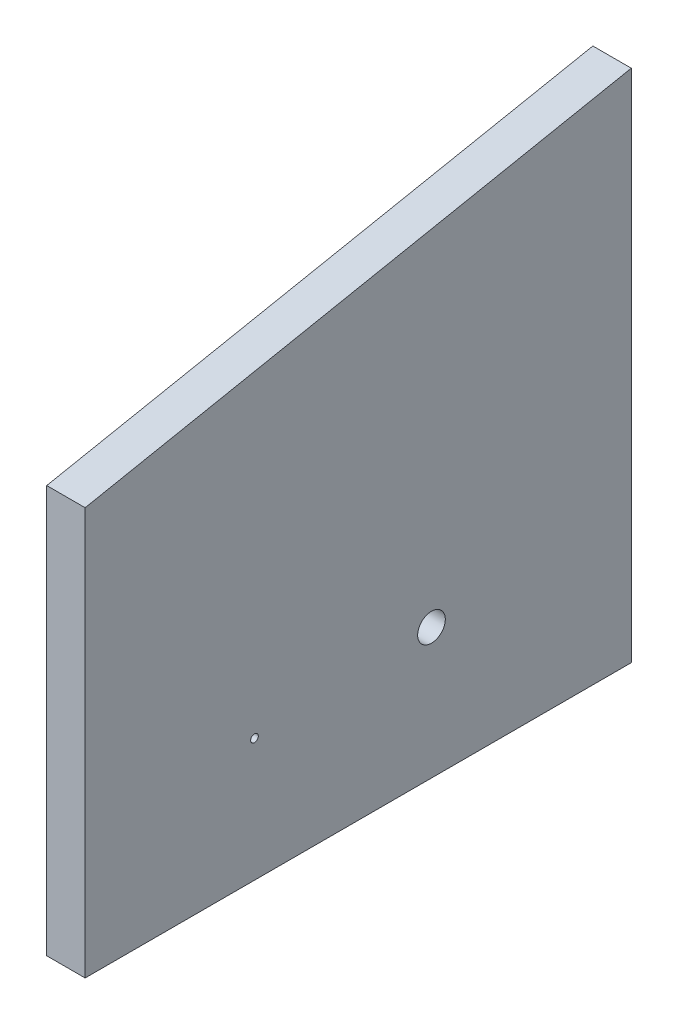
from build123d import *

# Parameters (mm, degrees)
SKETCH1_W                = 50
SKETCH1_H                = 9.1
BOSS_EXTRUDE1_DEPTH      = 2
SKETCH2_W                = 25
SKETCH2_H                = 6.6
CUT_EXTRUDE1_DEPTH       = 2
SKETCH3_R                = 1.8
CUT_EXTRUDE2_DEPTH       = 2
SKETCH4_W                = 66.4
SKETCH4_H                = 130
BOSS_EXTRUDE2_DEPTH      = 2
SKETCH5_W                = 66.4
SKETCH5_H                = 2
BOSS_EXTRUDE3_DEPTH      = 2.5
SKETCH6_W                = 8.6
SKETCH6_H                = 62.5
BOSS_EXTRUDE4_DEPTH      = 2
SKETCH7_R                = 1.8
SKETCH7_W                = 3
SKETCH7_H                = 5
CUT_EXTRUDE3_DEPTH       = 2
SKETCH8_W                = 25
SKETCH8_H                = 45
CUT_EXTRUDE4_DEPTH       = 20
SKETCH9_W                = 25
SKETCH9_H                = 10
BOSS_EXTRUDE5_DEPTH      = 2
SKETCH10_W               = 34.7
SKETCH10_H               = 27.07
BOSS_EXTRUDE6_DEPTH      = 2
SKETCH11_R               = 1.8
CUT_EXTRUDE5_DEPTH       = 2
SKETCH12_R               = 1.8
CUT_EXTRUDE6_DEPTH       = 2
SKETCH13_W               = 2
SKETCH13_H               = 2
BOSS_EXTRUDE7_DEPTH      = 44
SKETCH14_W               = 2
SKETCH14_H               = 2
BOSS_EXTRUDE8_DEPTH      = 46
SKETCH16_W               = 42
SKETCH16_H               = 43
BOSS_EXTRUDE10_DEPTH     = 2
SKETCH18_R               = 1.8
CUT_EXTRUDE7_DEPTH       = 2
BOSS_EXTRUDE12_DEPTH     = 2
SKETCH21_W               = 2
SKETCH21_H               = 2
BOSS_EXTRUDE13_DEPTH     = 10
SKETCH25_W               = 3
SKETCH25_H               = 5
CUT_EXTRUDE8_DEPTH       = 10
SKETCH26_W               = 6.2
SKETCH26_H               = 13
SKETCH26_W_2             = 21
SKETCH26_H_2             = 6.6
BOSS_EXTRUDE14_DEPTH     = 2
SKETCH27_W               = 2
SKETCH27_H               = 27
SKETCH27_H_2             = 24.93
BOSS_EXTRUDE15_DEPTH     = 2
SKETCH29_W               = 10
SKETCH29_H               = 10
BOSS_EXTRUDE19_DEPTH     = 2
SKETCH41_R               = 1.8
CUT_EXTRUDE15_DEPTH      = 2
BOSS_EXTRUDE26_DEPTH     = 2
SKETCH43_W               = 70.4
SKETCH43_H               = 2
BOSS_EXTRUDE27_DEPTH     = 11
SKETCH44_W               = 10
SKETCH44_H               = 5
BOSS_EXTRUDE28_DEPTH     = 2
SKETCH45_R               = 1.8
BOSS_EXTRUDE29_DEPTH     = 2
SKETCH46_R               = 1.8
CUT_EXTRUDE16_DEPTH      = 2
SKETCH47_W               = 10
SKETCH47_H               = 1
BOSS_EXTRUDE30_DEPTH     = 2
SKETCH48_W               = 32.7
SKETCH48_H               = 31.07
SKETCH48_W_2             = 101.75
SKETCH48_H_2             = 120.487369876
CUT_EXTRUDE17_DEPTH      = 20
SKETCH50_W               = 66.4
SKETCH50_H               = 81.07
CUT_EXTRUDE19_DEPTH      = 20
SKETCH51_W               = 70.4
SKETCH51_H               = 85.07
SKETCH51_W_2             = 66.4
SKETCH51_H_2             = 81.07
BOSS_EXTRUDE31_DEPTH     = 20
SKETCH52_W               = 10
SKETCH52_H               = 1
BOSS_EXTRUDE32_DEPTH     = 2
SKETCH53_W               = 10
SKETCH53_H               = 4
CUT_EXTRUDE20_DEPTH      = 2
BOSS_EXTRUDE33_START     = 1
SKETCH54_W               = 10
SKETCH54_H               = 12
SKETCH54_R               = 1.8
BOSS_EXTRUDE33_DEPTH     = 1
CUT_EXTRUDE23_DEPTH      = 96
CUT_EXTRUDE23_DEPTH_BACK = 16
SKETCH59_R               = 1.8
SKETCH62_W               = 66.985033768
SKETCH62_H               = 11.249394984
BOSS_EXTRUDE38_DEPTH     = 1
SKETCH65_R               = 1.8
CUT_EXTRUDE27_DEPTH      = 3
SKETCH66_R               = 1
CUT_EXTRUDE28_DEPTH      = 87
BOSS_EXTRUDE41_DEPTH     = 2
BOSS_EXTRUDE42_DEPTH     = 2
BOSS_EXTRUDE43_DEPTH     = 2
SKETCH68_W               = 6.791832398
SKETCH68_H               = 8.144168394
SKETCH68_W_2             = 5.485710784
SKETCH68_W_3             = 7.764004839
SKETCH68_H_2             = 11.628907231
BOSS_EXTRUDE44_DEPTH     = 2
BOSS_EXTRUDE45_DEPTH     = 2
SKETCH70_R               = 1.8
CUT_EXTRUDE29_DEPTH      = 83
CUT_EXTRUDE30_DEPTH      = 75
CUT_EXTRUDE30_DEPTH_BACK = 16
SKETCH71_W               = 5.876146553
SKETCH71_H               = 39.481516924
SKETCH72_W               = 79.610987064
SKETCH72_H               = 92.479142301
CUT_EXTRUDE31_DEPTH      = 40
CUT_EXTRUDE32_DEPTH      = 43
CUT_EXTRUDE32_DEPTH_BACK = 22
SKETCH73_W               = 7.125351406
SKETCH73_H               = 50.874914307
SKETCH74_W               = 52.254946006
SKETCH74_H               = 40.33481622
CUT_EXTRUDE33_DEPTH      = 68
BOSS_EXTRUDE46_START     = 3
SKETCH75_W               = 81.07
SKETCH75_H               = 22
SKETCH75_R               = 1.8
SKETCH75_R_2             = 1
BOSS_EXTRUDE46_DEPTH     = 3
SKETCH76_R               = 1.8
SKETCH76_R_2             = 1
SKETCH76_R_3             = 0.5
BOSS_EXTRUDE47_DEPTH     = 5
SKETCH77_W               = 5
SKETCH77_H               = 22
CUT_EXTRUDE34_DEPTH      = 5
SKETCH78_W               = 5
SKETCH78_H               = 22
CUT_EXTRUDE35_DEPTH      = 5
BOSS_EXTRUDE49_DEPTH     = 5


with BuildPart() as part:
    # Sketch1 → Boss-Extrude1 (new body)
    with BuildSketch(Plane(origin=(0, 0, 0), x_dir=(1, 0, 0), z_dir=(0, 1, 0))):
        with Locations((25, 4.55)):
            Rectangle(SKETCH1_W, SKETCH1_H)
    extrude(amount=BOSS_EXTRUDE1_DEPTH)

    # Sketch2 → Cut-Extrude1 (cut)
    with BuildSketch(Plane(origin=(0, 2, 0), x_dir=(1, 0, 0), z_dir=(0, 1, 0))):
        with Locations((25, 5.8)):
            Rectangle(SKETCH2_W, SKETCH2_H)
    extrude(amount=-CUT_EXTRUDE1_DEPTH, mode=Mode.SUBTRACT)

    # Sketch3 → Cut-Extrude2 (cut)
    with BuildSketch(Plane(origin=(0, 2, 0), x_dir=(1, 0, 0), z_dir=(0, 1, 0))):
        with Locations(Location((6.25, 5.8, 0), (0, 0, 270))):
            Circle(SKETCH3_R)
        with Locations(Location((43.75, 5.8, 0), (0, 0, 270))):
            Circle(SKETCH3_R)
    extrude(amount=-CUT_EXTRUDE2_DEPTH, mode=Mode.SUBTRACT)

    # Sketch4 → Boss-Extrude2 (add)
    with BuildSketch(Plane(origin=(0, 2, 0), x_dir=(1, 0, 0), z_dir=(0, 1, 0))):
        with Locations((25, -65)):
            Rectangle(SKETCH4_W, SKETCH4_H)
    extrude(amount=-BOSS_EXTRUDE2_DEPTH)

    # Sketch5 → Boss-Extrude3 (add)
    with BuildSketch(Plane.XY.offset(130)):
        with Locations((25, 1)):
            Rectangle(SKETCH5_W, SKETCH5_H)
    extrude(amount=BOSS_EXTRUDE3_DEPTH)

    # Sketch6 → Boss-Extrude4 (add)
    with BuildSketch(Plane(origin=(0, 2, 0), x_dir=(1, 0, 0), z_dir=(0, 1, 0))):
        with Locations((-12.5, -101.25)):
            Rectangle(SKETCH6_W, SKETCH6_H)
        with Locations((62.5, -101.25)):
            Rectangle(SKETCH6_W, SKETCH6_H)
    extrude(amount=-BOSS_EXTRUDE4_DEPTH)

    # Sketch7 → Cut-Extrude3 (cut)
    with BuildSketch(Plane(origin=(0, 2, 0), x_dir=(1, 0, 0), z_dir=(0, 1, 0))):
        with Locations(Location((-13.5, -77, 0), (0, 0, 270))):
            Circle(SKETCH7_R)
        with Locations(Location((-13.5, -101.25, 0), (0, 0, 270))):
            Circle(SKETCH7_R)
        with Locations(Location((-13.5, -125.5, 0), (0, 0, 270))):
            Circle(SKETCH7_R)
        with Locations(Location((63.5, -77, 0), (0, 0, 270))):
            Circle(SKETCH7_R)
        with Locations(Location((63.5, -101.25, 0), (0, 0, 270))):
            Circle(SKETCH7_R)
        with Locations(Location((63.5, -125.5, 0), (0, 0, 270))):
            Circle(SKETCH7_R)
        with Locations((-13.5, -117.5)):
            Rectangle(SKETCH7_W, SKETCH7_H)
        with Locations((63.5, -117.5)):
            Rectangle(SKETCH7_W, SKETCH7_H)
    extrude(amount=-CUT_EXTRUDE3_DEPTH, mode=Mode.SUBTRACT)

    # Sketch8 → Cut-Extrude4 (cut)
    with BuildSketch(Plane(origin=(0, 2, 0), x_dir=(1, 0, 0), z_dir=(0, 1, 0))):
        with Locations((25, -22.5)):
            Rectangle(SKETCH8_W, SKETCH8_H)
    extrude(amount=-CUT_EXTRUDE4_DEPTH, mode=Mode.SUBTRACT)

    # Sketch9 → Boss-Extrude5 (add)
    with BuildSketch(Plane(origin=(0, 2, 0), x_dir=(1, 0, 0), z_dir=(0, 1, 0))):
        with Locations((25, -5)):
            Rectangle(SKETCH9_W, SKETCH9_H)
    extrude(amount=-BOSS_EXTRUDE5_DEPTH)

    # Sketch10 → Boss-Extrude6 (add)
    with BuildSketch(Plane(origin=(0, 2, 0), x_dir=(1, 0, 0), z_dir=(0, 1, 0))):
        with Locations((-25.55, -29.535)):
            Rectangle(SKETCH10_W, SKETCH10_H)
        with Locations((75.55, -29.535)):
            Rectangle(SKETCH10_W, SKETCH10_H)
    extrude(amount=-BOSS_EXTRUDE6_DEPTH)

    # Sketch11 → Cut-Extrude5 (cut)
    with BuildSketch(Plane(origin=(0, 2, 0), x_dir=(1, 0, 0), z_dir=(0, 1, 0))):
        with Locations(Location((-36.9, -19.25, 0), (0, 0, 270))):
            Circle(SKETCH11_R)
        with Locations(Location((-36.9, -39.82, 0), (0, 0, 270))):
            Circle(SKETCH11_R)
        with Locations(Location((-22.6, -19.25, 0), (0, 0, 270))):
            Circle(SKETCH11_R)
        with Locations(Location((-22.6, -39.82, 0), (0, 0, 270))):
            Circle(SKETCH11_R)
    extrude(amount=-CUT_EXTRUDE5_DEPTH, mode=Mode.SUBTRACT)

    # Sketch12 → Cut-Extrude6 (cut)
    with BuildSketch(Plane(origin=(0, 2, 0), x_dir=(1, 0, 0), z_dir=(0, 1, 0))):
        with Locations(Location((72.6, -19.25, 0), (0, 0, 270))):
            Circle(SKETCH12_R)
        with Locations(Location((86.9, -19.25, 0), (0, 0, 270))):
            Circle(SKETCH12_R)
        with Locations(Location((72.6, -39.82, 0), (0, 0, 270))):
            Circle(SKETCH12_R)
        with Locations(Location((86.9, -39.82, 0), (0, 0, 270))):
            Circle(SKETCH12_R)
    extrude(amount=-CUT_EXTRUDE6_DEPTH, mode=Mode.SUBTRACT)

    # Sketch13 → Boss-Extrude7 (add)
    with BuildSketch(Plane.ZY.offset(42.9)):
        with Locations((15, 1)):
            Rectangle(SKETCH13_W, SKETCH13_H)
        with Locations((44.07, 1)):
            Rectangle(SKETCH13_W, SKETCH13_H)
    extrude(amount=-BOSS_EXTRUDE7_DEPTH)

    # Sketch14 → Boss-Extrude8 (add)
    with BuildSketch(Plane(origin=(92.9, 0, 0), x_dir=(0, 0, -1), z_dir=(1, 0, 0))):
        with Locations((-15, 1)):
            Rectangle(SKETCH14_W, SKETCH14_H)
        with Locations((-44.07, 1)):
            Rectangle(SKETCH14_W, SKETCH14_H)
    extrude(amount=-BOSS_EXTRUDE8_DEPTH)

    # Sketch16 → Boss-Extrude10 (add)
    with BuildSketch(Plane(origin=(0, 2, 0), x_dir=(1, 0, 0), z_dir=(0, 1, 0))):
        with Locations((25, -154)):
            Rectangle(SKETCH16_W, SKETCH16_H)
    extrude(amount=-BOSS_EXTRUDE10_DEPTH)

    # Sketch18 → Cut-Extrude7 (cut)
    with BuildSketch(Plane(origin=(0, 2, 0), x_dir=(1, 0, 0), z_dir=(0, 1, 0))):
        with Locations(Location((8.74, -171.03, 0), (0, 0, 270))):
            Circle(SKETCH18_R)
        with Locations(Location((41.26, -171.03, 0), (0, 0, 270))):
            Circle(SKETCH18_R)
        with Locations(Location((8.74, -138.5, 0), (0, 0, 270))):
            Circle(SKETCH18_R)
        with Locations(Location((41.26, -138.5, 0), (0, 0, 270))):
            Circle(SKETCH18_R)
    extrude(amount=-CUT_EXTRUDE7_DEPTH, mode=Mode.SUBTRACT)

    # Sketch20 → Boss-Extrude12 (add)
    with BuildSketch(Plane(origin=(0, 2, 0), x_dir=(1, 0, 0), z_dir=(0, 1, 0))):
        with BuildLine():
            Line((-2, -132.5), (4, -132.5))
            Line((4, -132.5), (4, -138.5))
            ThreePointArc((4, -138.5), (2.242640687, -134.257359313), (-2, -132.5))
        make_face()
        with BuildLine():
            ThreePointArc((52, -132.5), (47.757359313, -134.257359313), (46, -138.5))
            Line((46, -138.5), (46, -132.5))
            Line((46, -132.5), (52, -132.5))
        make_face()
    extrude(amount=-BOSS_EXTRUDE12_DEPTH)

    # Sketch21 → Boss-Extrude13 (add)
    with BuildSketch(Plane(origin=(0, 0, -9.1), x_dir=(-1, 0, 0), z_dir=(0, 0, -1))):
        with Locations((-51, 1)):
            Rectangle(SKETCH21_W, SKETCH21_H)
        with Locations((-36.5, 1)):
            Rectangle(SKETCH21_W, SKETCH21_H)
        with Locations((-13.5, 1)):
            Rectangle(SKETCH21_W, SKETCH21_H)
        with Locations((1, 1)):
            Rectangle(SKETCH21_W, SKETCH21_H)
    extrude(amount=-BOSS_EXTRUDE13_DEPTH)

    # Sketch25 → Cut-Extrude8 (cut)
    with BuildSketch(Plane(origin=(0, 2, 0), x_dir=(1, 0, 0), z_dir=(0, 1, 0))):
        with Locations((-11.7, -22.5)):
            Rectangle(SKETCH25_W, SKETCH25_H)
        with Locations((-11.7, -36.57)):
            Rectangle(SKETCH25_W, SKETCH25_H)
        with Locations((61.7, -22.5)):
            Rectangle(SKETCH25_W, SKETCH25_H)
        with Locations((61.7, -36.57)):
            Rectangle(SKETCH25_W, SKETCH25_H)
    extrude(amount=-CUT_EXTRUDE8_DEPTH, mode=Mode.SUBTRACT)

    # Sketch26 → Boss-Extrude14 (add)
    with BuildSketch(Plane(origin=(0, 2, 0), x_dir=(1, 0, 0), z_dir=(0, 1, 0))):
        with Locations((-5.1, 6.5)):
            Rectangle(SKETCH26_W, SKETCH26_H)
        Polygon((-2, 13), (-2, 9.1), (14.5, 9.1), (35.5, 9.1), (52, 9.1), (52, 13), align=None)
        with Locations((25, 5.8)):
            Rectangle(SKETCH26_W_2, SKETCH26_H_2)
        with Locations((55.1, 6.5)):
            Rectangle(SKETCH26_W, SKETCH26_H)
    extrude(amount=-BOSS_EXTRUDE14_DEPTH)

    # Sketch27 → Boss-Extrude15 (add)
    with BuildSketch(Plane(origin=(0, 2, 0), x_dir=(1, 0, 0), z_dir=(0, 1, 0))):
        with Locations((-9.2, -0.5)):
            Rectangle(SKETCH27_W, SKETCH27_H)
        with Locations((-9.2, -57.535)):
            Rectangle(SKETCH27_W, SKETCH27_H_2)
        with Locations((59.2, -0.5)):
            Rectangle(SKETCH27_W, SKETCH27_H)
        with Locations((59.2, -57.535)):
            Rectangle(SKETCH27_W, SKETCH27_H_2)
    extrude(amount=-BOSS_EXTRUDE15_DEPTH)

    # Sketch29 → Boss-Extrude19 (add)
    with BuildSketch(Plane(origin=(0, 2, 0), x_dir=(1, 0, 0), z_dir=(0, 1, 0))):
        with Locations((-15.2, -9)):
            Rectangle(SKETCH29_W, SKETCH29_H)
        with Locations((-15.2, -50.07)):
            Rectangle(SKETCH29_W, SKETCH29_H)
        with Locations((65.2, -9)):
            Rectangle(SKETCH29_W, SKETCH29_H)
        with Locations((65.2, -50.07)):
            Rectangle(SKETCH29_W, SKETCH29_H)
    extrude(amount=-BOSS_EXTRUDE19_DEPTH)

    # Sketch41 → Cut-Extrude15 (cut)
    with BuildSketch(Plane(origin=(0, 2, 0), x_dir=(1, 0, 0), z_dir=(0, 1, 0))):
        with Locations(Location((-15.2, -9, 0), (0, 0, 270))):
            Circle(SKETCH41_R)
        with Locations(Location((-15.2, -50.07, 0), (0, 0, 270))):
            Circle(SKETCH41_R)
        with Locations(Location((65.2, -9, 0), (0, 0, 270))):
            Circle(SKETCH41_R)
        with Locations(Location((65.2, -50.07, 0), (0, 0, 270))):
            Circle(SKETCH41_R)
    extrude(amount=-CUT_EXTRUDE15_DEPTH, mode=Mode.SUBTRACT)

    # Sketch42 → Boss-Extrude26 (add)
    with BuildSketch(Plane(origin=(0, 2, 0), x_dir=(1, 0, 0), z_dir=(0, 1, 0))):
        with BuildLine():
            Line((-16.8, -70), (-10.2, -70))
            Line((-10.2, -70), (-10.2, -63.4))
            ThreePointArc((-10.2, -63.4), (-12.133095244, -68.066904756), (-16.8, -70))
        make_face()
        with BuildLine():
            Line((60.2, -63.4), (60.2, -70))
            Line((60.2, -70), (66.8, -70))
            ThreePointArc((66.8, -70), (62.133095244, -68.066904756), (60.2, -63.4))
        make_face()
    extrude(amount=-BOSS_EXTRUDE26_DEPTH)

    # Sketch43 → Boss-Extrude27 (add)
    with BuildSketch(Plane(origin=(0, 0, -13), x_dir=(-1, 0, 0), z_dir=(0, 0, -1))):
        with Locations((-25, 1)):
            Rectangle(SKETCH43_W, SKETCH43_H)
    extrude(amount=BOSS_EXTRUDE27_DEPTH)

    # Sketch44 → Boss-Extrude28 (add)
    with BuildSketch(Plane(origin=(0, 2, 0), x_dir=(1, 0, 0), z_dir=(0, 1, 0))):
        with Locations((-15.2, -57.57)):
            Rectangle(SKETCH44_W, SKETCH44_H)
        with Locations((65.2, -57.57)):
            Rectangle(SKETCH44_W, SKETCH44_H)
    extrude(amount=-BOSS_EXTRUDE28_DEPTH)

    # Sketch45 → Boss-Extrude29 (add)
    with BuildSketch(Plane(origin=(0, 2, 0), x_dir=(1, 0, 0), z_dir=(0, 1, 0))):
        with Locations((-15.2, -50.07)):
            Circle(SKETCH45_R)
        with Locations((65.2, -50.07)):
            Circle(SKETCH45_R)
    extrude(amount=-BOSS_EXTRUDE29_DEPTH)

    # Sketch46 → Cut-Extrude16 (cut)
    with BuildSketch(Plane(origin=(0, 2, 0), x_dir=(1, 0, 0), z_dir=(0, 1, 0))):
        with Locations(Location((-15.2, -55.07, 0), (0, 0, 270))):
            Circle(SKETCH46_R)
        with Locations(Location((65.2, -55.07, 0), (0, 0, 270))):
            Circle(SKETCH46_R)
    extrude(amount=-CUT_EXTRUDE16_DEPTH, mode=Mode.SUBTRACT)

    # Sketch47 → Boss-Extrude30 (add)
    with BuildSketch(Plane(origin=(0, 2, 0), x_dir=(1, 0, 0), z_dir=(0, 1, 0))):
        with Locations((-15.2, -3.5)):
            Rectangle(SKETCH47_W, SKETCH47_H)
        with Locations((-15.2, -60.57)):
            Rectangle(SKETCH47_W, SKETCH47_H)
        with Locations((65.2, -3.5)):
            Rectangle(SKETCH47_W, SKETCH47_H)
        with Locations((65.2, -60.57)):
            Rectangle(SKETCH47_W, SKETCH47_H)
    extrude(amount=-BOSS_EXTRUDE30_DEPTH)

    # Sketch48 → Cut-Extrude17 (cut)
    with BuildSketch(Plane(origin=(0, 2, 0), x_dir=(1, 0, 0), z_dir=(0, 1, 0))):
        with Locations((-26.55, -29.535)):
            Rectangle(SKETCH48_W, SKETCH48_H)
        with Locations((76.55, -29.535)):
            Rectangle(SKETCH48_W, SKETCH48_H)
        with Locations((30.675, -121.313684938)):
            Rectangle(SKETCH48_W_2, SKETCH48_H_2)
    extrude(amount=-CUT_EXTRUDE17_DEPTH, mode=Mode.SUBTRACT)

    # Sketch50 → Cut-Extrude19 (cut)
    with BuildSketch(Plane(origin=(0, 2, 0), x_dir=(1, 0, 0), z_dir=(0, 1, 0))):
        with Locations((25, -18.535)):
            Rectangle(SKETCH50_W, SKETCH50_H)
    extrude(amount=-CUT_EXTRUDE19_DEPTH, mode=Mode.SUBTRACT)

    # Sketch51 → Boss-Extrude31 (add)
    with BuildSketch(Plane(origin=(0, 2, 0), x_dir=(1, 0, 0), z_dir=(0, 1, 0))):
        with Locations((25, -18.535)):
            Rectangle(SKETCH51_W, SKETCH51_H)
        with Locations((25, -18.535)):
            Rectangle(SKETCH51_W_2, SKETCH51_H_2, mode=Mode.SUBTRACT)
    extrude(amount=BOSS_EXTRUDE31_DEPTH)

    # Sketch52 → Boss-Extrude32 (add)
    with BuildSketch(Plane(origin=(0, 2, 0), x_dir=(1, 0, 0), z_dir=(0, 1, 0))):
        with Locations((-15.2, -14.5)):
            Rectangle(SKETCH52_W, SKETCH52_H)
        with Locations((65.2, -14.5)):
            Rectangle(SKETCH52_W, SKETCH52_H)
    extrude(amount=-BOSS_EXTRUDE32_DEPTH)

    # Sketch53 → Cut-Extrude20 (cut)
    with BuildSketch(Plane(origin=(0, 2, 0), x_dir=(1, 0, 0), z_dir=(0, 1, 0))):
        with Locations((-15.2, -47.07)):
            Rectangle(SKETCH53_W, SKETCH53_H)
        with Locations((65.2, -47.07)):
            Rectangle(SKETCH53_W, SKETCH53_H)
    extrude(amount=-CUT_EXTRUDE20_DEPTH, mode=Mode.SUBTRACT)

    # Sketch54 → Boss-Extrude33 (add)
    # profile 1 of 4: a face of its own
    with BuildSketch(Plane(origin=(0, 2, 0), x_dir=(1, 0, 0), z_dir=(0, 1, 0)).offset(BOSS_EXTRUDE33_START)):
        with Locations((-15.2, -9)):
            Rectangle(SKETCH54_W, SKETCH54_H)
        with Locations(Location((-15.2, -9, 0), (0, 0, 270))):
            Circle(SKETCH54_R, mode=Mode.SUBTRACT)
    # profile 2 of 4: a face of its own
    with BuildSketch(Plane(origin=(0, 2, 0), x_dir=(1, 0, 0), z_dir=(0, 1, 0)).offset(BOSS_EXTRUDE33_START)):
        with Locations((-15.2, -55.07)):
            Rectangle(SKETCH54_W, SKETCH54_H)
        with Locations(Location((-15.2, -55.07, 0), (0, 0, 270))):
            Circle(SKETCH54_R, mode=Mode.SUBTRACT)
    # profile 3 of 4: a face of its own
    with BuildSketch(Plane(origin=(0, 2, 0), x_dir=(1, 0, 0), z_dir=(0, 1, 0)).offset(BOSS_EXTRUDE33_START)):
        with Locations((65.2, -9)):
            Rectangle(SKETCH54_W, SKETCH54_H)
        with Locations(Location((65.2, -9, 0), (0, 0, 270))):
            Circle(SKETCH54_R, mode=Mode.SUBTRACT)
    # profile 4 of 4: a face of its own
    with BuildSketch(Plane(origin=(0, 2, 0), x_dir=(1, 0, 0), z_dir=(0, 1, 0)).offset(BOSS_EXTRUDE33_START)):
        with Locations((65.2, -55.07)):
            Rectangle(SKETCH54_W, SKETCH54_H)
        with Locations(Location((65.2, -55.07, 0), (0, 0, 270))):
            Circle(SKETCH54_R, mode=Mode.SUBTRACT)
    extrude(amount=-BOSS_EXTRUDE33_DEPTH)

    # Sketch59 → Cut-Extrude23 (cut, two sides: drawn at the far end of the back side and taken through both)
    with BuildSketch(Plane.XY.offset(-22).offset(-CUT_EXTRUDE23_DEPTH_BACK)):
        with Locations((-3.2, 11)):
            Circle(SKETCH59_R)
        with Locations((53.2, 11)):
            Circle(SKETCH59_R)
        with Locations((25, 11)):
            Circle(SKETCH59_R)
    extrude(amount=CUT_EXTRUDE23_DEPTH + CUT_EXTRUDE23_DEPTH_BACK, mode=Mode.SUBTRACT)

    # Sketch62 → Boss-Extrude38 (add)
    with BuildSketch(Plane.XY.offset(61.07)):
        with Locations((24.914777311, 10.744331932)):
            Rectangle(SKETCH62_W, SKETCH62_H)
    extrude(amount=-BOSS_EXTRUDE38_DEPTH)

    # Sketch65 → Cut-Extrude27 (cut)
    with BuildSketch(Plane(origin=(0, 0, 59.07), x_dir=(-1, 0, 0), z_dir=(0, 0, -1))):
        with Locations((-13.8, 11)):
            Circle(SKETCH65_R)
        with Locations((-36.2, 11)):
            Circle(SKETCH65_R)
    extrude(amount=-CUT_EXTRUDE27_DEPTH, mode=Mode.SUBTRACT)

    # Sketch66 → Cut-Extrude28 (cut)
    with BuildSketch(Plane.ZY.offset(10.2)):
        with Locations((32.035, 16)):
            Circle(SKETCH66_R)
    extrude(amount=-CUT_EXTRUDE28_DEPTH, mode=Mode.SUBTRACT)

    # Sketch55 → Boss-Extrude41 (add)
    with BuildSketch(Plane(origin=(0, 0, 3), x_dir=(-1, 0, 0), z_dir=(0, 0, -1))):
        Polygon((20.2, 3), (10.2, 22), (10.2, 3), align=None)
        Polygon((-70.2, 3), (-60.2, 3), (-60.2, 22), align=None)
    extrude(amount=-BOSS_EXTRUDE41_DEPTH)

    # Sketch56 → Boss-Extrude42 (add)
    with BuildSketch(Plane.XY.offset(15)):
        Polygon((-20.2, 3), (-10.2, 3), (-10.2, 22), align=None)
        Polygon((70.2, 3), (60.2, 3), (60.2, 22), align=None)
    extrude(amount=-BOSS_EXTRUDE42_DEPTH)

    # Sketch57 → Boss-Extrude43 (add)
    with BuildSketch(Plane(origin=(0, 0, 49.07), x_dir=(-1, 0, 0), z_dir=(0, 0, -1))):
        Polygon((20.2, 3), (10.2, 3), (10.2, 22), align=None)
        Polygon((-70.2, 3), (-60.2, 3), (-60.2, 22), align=None)
    extrude(amount=-BOSS_EXTRUDE43_DEPTH)

    # Sketch68 → Boss-Extrude44 (add)
    with BuildSketch(Plane(origin=(0, 0, 59.07), x_dir=(-1, 0, 0), z_dir=(0, 0, -1))):
        with Locations((2.499419559, 10.346452983)):
            Rectangle(SKETCH68_W, SKETCH68_H)
        with Locations((-24.624372648, 10.346452983)):
            Rectangle(SKETCH68_W_2, SKETCH68_H)
        with Locations((-52.231743322, 12.088822401)):
            Rectangle(SKETCH68_W_3, SKETCH68_H_2)
    extrude(amount=-BOSS_EXTRUDE44_DEPTH)

    # Sketch69 → Boss-Extrude45 (add)
    with BuildSketch(Plane.XY.offset(61.07)):
        Polygon((-20.2, 3), (-10.2, 3), (-10.2, 22), align=None)
        Polygon((60.2, 3), (70.2, 3), (60.2, 22), align=None)
    extrude(amount=-BOSS_EXTRUDE45_DEPTH)

    # Sketch70 → Cut-Extrude29 (cut)
    with BuildSketch(Plane.ZY.offset(10.2)):
        with Locations((9, 17)):
            Circle(SKETCH70_R)
        with Locations((55.07, 17)):
            Circle(SKETCH70_R)
    extrude(amount=-CUT_EXTRUDE29_DEPTH, mode=Mode.SUBTRACT)

    # Sketch71 → Cut-Extrude30 (cut, two sides: drawn at the far end of the back side and taken through both)
    with BuildSketch(Plane(origin=(-8.2, 0, 0), x_dir=(0, 0, -1), z_dir=(1, 0, 0)).offset(-CUT_EXTRUDE30_DEPTH_BACK)):
        with Locations((24.938073276, 2.259241538)):
            Rectangle(SKETCH71_W, SKETCH71_H)
    extrude(amount=CUT_EXTRUDE30_DEPTH + CUT_EXTRUDE30_DEPTH_BACK, mode=Mode.SUBTRACT)

    # Sketch72 → Cut-Extrude31 (cut)
    with BuildSketch(Plane(origin=(0, 22, 0), x_dir=(1, 0, 0), z_dir=(0, 1, 0))):
        with Locations((38.564043948, -20.250754032)):
            Rectangle(SKETCH72_W, SKETCH72_H)
    extrude(amount=-CUT_EXTRUDE31_DEPTH, mode=Mode.SUBTRACT)

    # Sketch73 → Cut-Extrude32 (cut, two sides: drawn at the far end of the back side and taken through both)
    with BuildSketch(Plane(origin=(-8.2, 0, 0), x_dir=(0, 0, -1), z_dir=(1, 0, 0)).offset(-CUT_EXTRUDE32_DEPTH_BACK)):
        with Locations((-62.632675703, -3.437457154)):
            Rectangle(SKETCH73_W, SKETCH73_H)
    extrude(amount=CUT_EXTRUDE32_DEPTH + CUT_EXTRUDE32_DEPTH_BACK, mode=Mode.SUBTRACT)

    # Sketch74 → Cut-Extrude33 (cut)
    with BuildSketch(Plane(origin=(0, 0, 3), x_dir=(-1, 0, 0), z_dir=(0, 0, -1))):
        with Locations((36.327473003, 20.16740811)):
            Rectangle(SKETCH74_W, SKETCH74_H)
    extrude(amount=-CUT_EXTRUDE33_DEPTH, mode=Mode.SUBTRACT)

    # Sketch75 → Boss-Extrude46 (add)
    with BuildSketch(Plane.ZY.offset(10.2).offset(BOSS_EXTRUDE46_START)):
        with Locations((18.535, 11)):
            Rectangle(SKETCH75_W, SKETCH75_H)
        with Locations((9, 17)):
            Circle(SKETCH75_R, mode=Mode.SUBTRACT)
        with Locations((32.035, 16)):
            Circle(SKETCH75_R_2, mode=Mode.SUBTRACT)
        with Locations((55.07, 17)):
            Circle(SKETCH75_R, mode=Mode.SUBTRACT)
    extrude(amount=-BOSS_EXTRUDE46_DEPTH)

    # Sketch76 → Boss-Extrude47 (add)
    # profile 1 of 2: a face of its own
    with BuildSketch(Plane.ZY.offset(13.2)):
        with Locations((55.07, 17)):
            Circle(SKETCH76_R)
    # profile 2 of 2: a face of its own
    with BuildSketch(Plane.ZY.offset(13.2)):
        with Locations((32.035, 16)):
            Circle(SKETCH76_R_2)
        with Locations((32.035, 16)):
            Circle(SKETCH76_R_3, mode=Mode.SUBTRACT)
    extrude(amount=-BOSS_EXTRUDE47_DEPTH)

    # Sketch77 → Cut-Extrude34 (cut)
    with BuildSketch(Plane.XY.offset(59.07)):
        with Locations((-10.7, 11)):
            Rectangle(SKETCH77_W, SKETCH77_H)
    extrude(amount=-CUT_EXTRUDE34_DEPTH, mode=Mode.SUBTRACT)

    # Sketch78 → Cut-Extrude35 (cut)
    with BuildSketch(Plane(origin=(0, 0, -22), x_dir=(-1, 0, 0), z_dir=(0, 0, -1))):
        with Locations((10.7, 11)):
            Rectangle(SKETCH78_W, SKETCH78_H)
    extrude(amount=-CUT_EXTRUDE35_DEPTH, mode=Mode.SUBTRACT)

    # Sketch79 → Boss-Extrude49 (add)
    with BuildSketch(Plane.ZY.offset(13.2)):
        Polygon((-17, 22), (-17, 67), (54.07, 53), (54.07, 22), align=None)
    extrude(amount=-BOSS_EXTRUDE49_DEPTH)


solid = part.part
